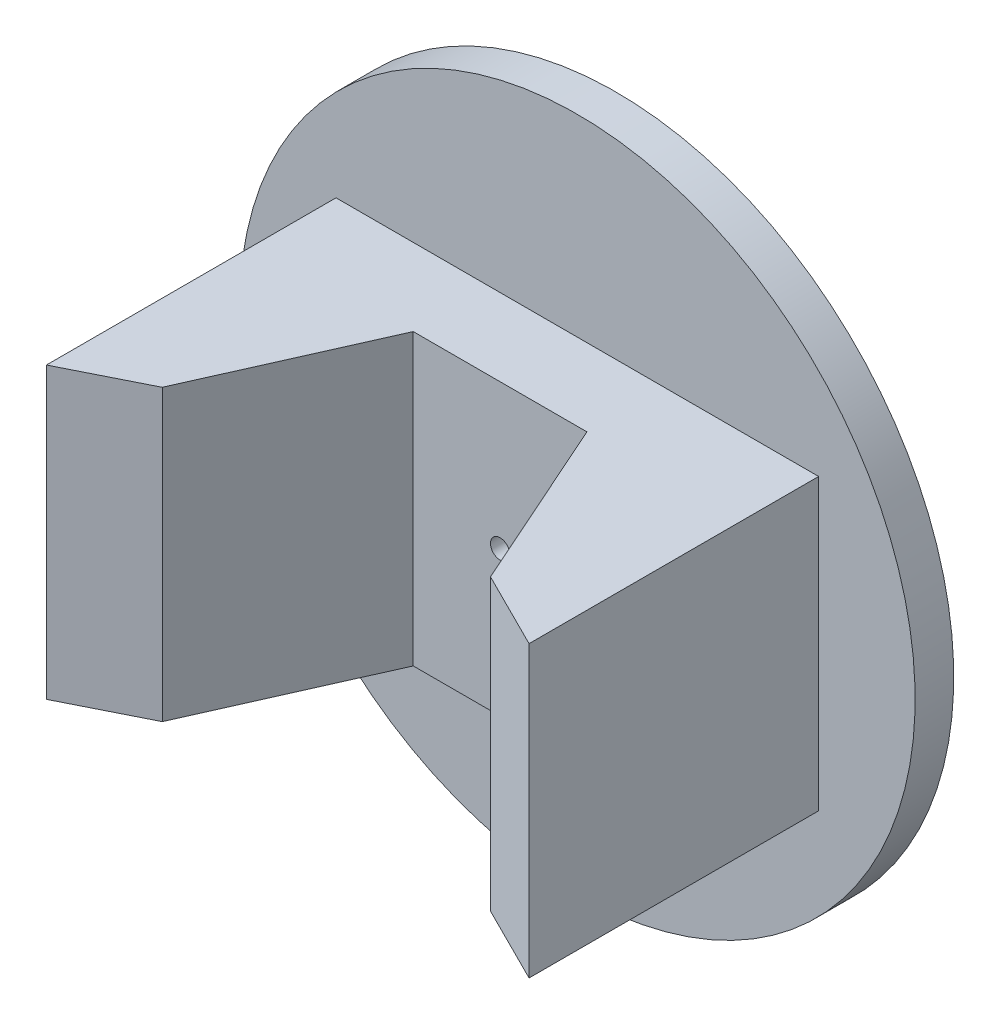
from build123d import *

# Parameters (mm, degrees)
SALIENTE_EXTRUIR1_DEPTH = 15
CROQUIS3_R              = 17.5
SALIENTE_EXTRUIR2_DEPTH = 2
CROQUIS4_R              = 10
SALIENTE_EXTRUIR3_DEPTH = 3
CROQUIS6_R              = 0.75
CROQUIS7_R              = 5
SALIENTE_EXTRUIR4_DEPTH = 3
CROQUIS8_R              = 0.5
CORTAR_EXTRUIR2_DEPTH   = 39.213217609


with BuildPart() as part:
    # Croquis1 → Saliente-Extruir1 (new body)
    with BuildSketch(Plane(origin=(0, 0, 0), x_dir=(1, 0, 0), z_dir=(0, 1, 0))):
        Polygon((8.5, -13), (4.5, -4), (-4.5, -4), (-8.5, -13), (-12.5, -15), (-12.5, 0), (12.5, 0), (12.5, -15), align=None)
    extrude(amount=SALIENTE_EXTRUIR1_DEPTH)

    # Croquis3 → Saliente-Extruir2 (add)
    with BuildSketch(Plane(origin=(0, 0, 0), x_dir=(-1, 0, 0), z_dir=(0, 0, -1))):
        with Locations((0, 7.5)):
            Circle(CROQUIS3_R)
    extrude(amount=SALIENTE_EXTRUIR2_DEPTH)

    # Croquis4 → Saliente-Extruir3 (add)
    with BuildSketch(Plane(origin=(0, 0, -2), x_dir=(-1, 0, 0), z_dir=(0, 0, -1))):
        with Locations((0, 7.5)):
            Circle(CROQUIS4_R)
    extrude(amount=SALIENTE_EXTRUIR3_DEPTH)

    # Croquis6 → Cortar-Revolución1 (revolve, cut)
    with BuildSketch(Plane(origin=(0, 0, 0), x_dir=(0, 0, -1), z_dir=(1, 0, 0)), mode=Mode.PRIVATE) as cortar_revoluci_n1_sk:
        with Locations((3.5, 17.5)):
            Circle(CROQUIS6_R)
    revolve(cortar_revoluci_n1_sk.sketch.rotate(Axis((0, 7.5, -5), (0, 0, 1)), 90), axis=Axis((0, 7.5, -5), (0, 0, 1)), mode=Mode.SUBTRACT)

    # Croquis7 → Saliente-Extruir4 (add)
    with BuildSketch(Plane(origin=(0, 0, -5), x_dir=(-1, 0, 0), z_dir=(0, 0, -1))):
        with Locations((0, 7.5)):
            Circle(CROQUIS7_R)
    extrude(amount=SALIENTE_EXTRUIR4_DEPTH)

    # Croquis8 → Cortar-Extruir2 (cut, through all)
    with BuildSketch(Plane(origin=(0, 0, -8), x_dir=(-1, 0, 0), z_dir=(0, 0, -1))):
        with Locations((0, 7.5)):
            Circle(CROQUIS8_R)
    extrude(amount=-CORTAR_EXTRUIR2_DEPTH, mode=Mode.SUBTRACT)


solid = part.part
